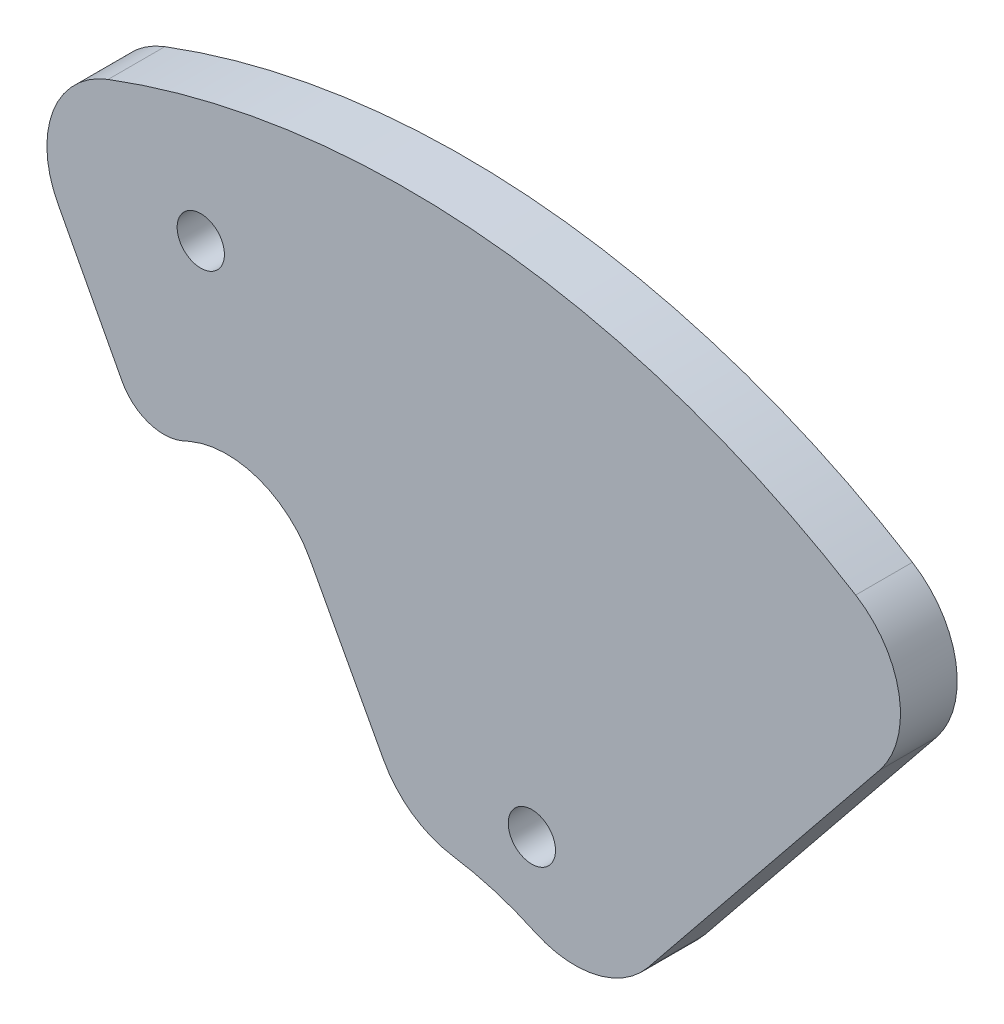
from build123d import *

# Parameters (mm, degrees)
ESQUISSE2_R        = 2.5
BOSS_EXTRU_1_DEPTH = 6


with BuildPart() as part:
    # Esquisse2 → Boss.-Extru.1 (new body)
    with BuildSketch(Plane.XY):
        with BuildLine():
            Line((-37.02318957, 70.208855809), (-30.229307699, 57.325290719))
            ThreePointArc((-30.229307699, 57.325290719), (-27.467524765, 54.941473247), (-23.821445078, 55.068491485))
            ThreePointArc((-23.821445078, 55.068491485), (-23.400055317, 55.248867963), (-22.977299871, 55.426019978))
            ThreePointArc((-22.977299871, 55.426019978), (-15.791425987, 55.608280441), (-10.339764744, 50.923262614))
            Line((-10.339764744, 50.923262614), (-2.578763956, 36.48608394))
            ThreePointArc((-2.578763956, 36.48608394), (0.469732203, 33.046139596), (4.735009448, 31.333260165))
            ThreePointArc((4.735009448, 31.333260165), (9.170996361, 30.332924896), (13.418131397, 28.707965042))
            ThreePointArc((13.418131397, 28.707965042), (19.90350488, 28.02390195), (25.431548669, 31.483489123))
            Line((25.431548669, 31.483489123), (30.097916289, 37.260311293))
            Line((30.097916289, 37.260311293), (37.702538192, 46.674603521))
            Line((37.702538192, 46.674603521), (49.875769926, 61.74469673))
            ThreePointArc((49.875769926, 61.74469673), (51.954878008, 69.706464375), (47.358753007, 76.532009732))
            ThreePointArc((47.358753007, 76.532009732), (8.724917717, 89.576089504), (-31.699918321, 84.232506661))
            ThreePointArc((-31.699918321, 84.232506661), (-37.526805742, 78.422186754), (-37.02318957, 70.208855809))
        make_face()
        with Locations((13.111796304, 37.260311293)):
            Circle(ESQUISSE2_R, mode=Mode.SUBTRACT)
        with Locations((-21.903504738, 74.340342212)):
            Circle(ESQUISSE2_R, mode=Mode.SUBTRACT)
    extrude(amount=BOSS_EXTRU_1_DEPTH)


solid = part.part
